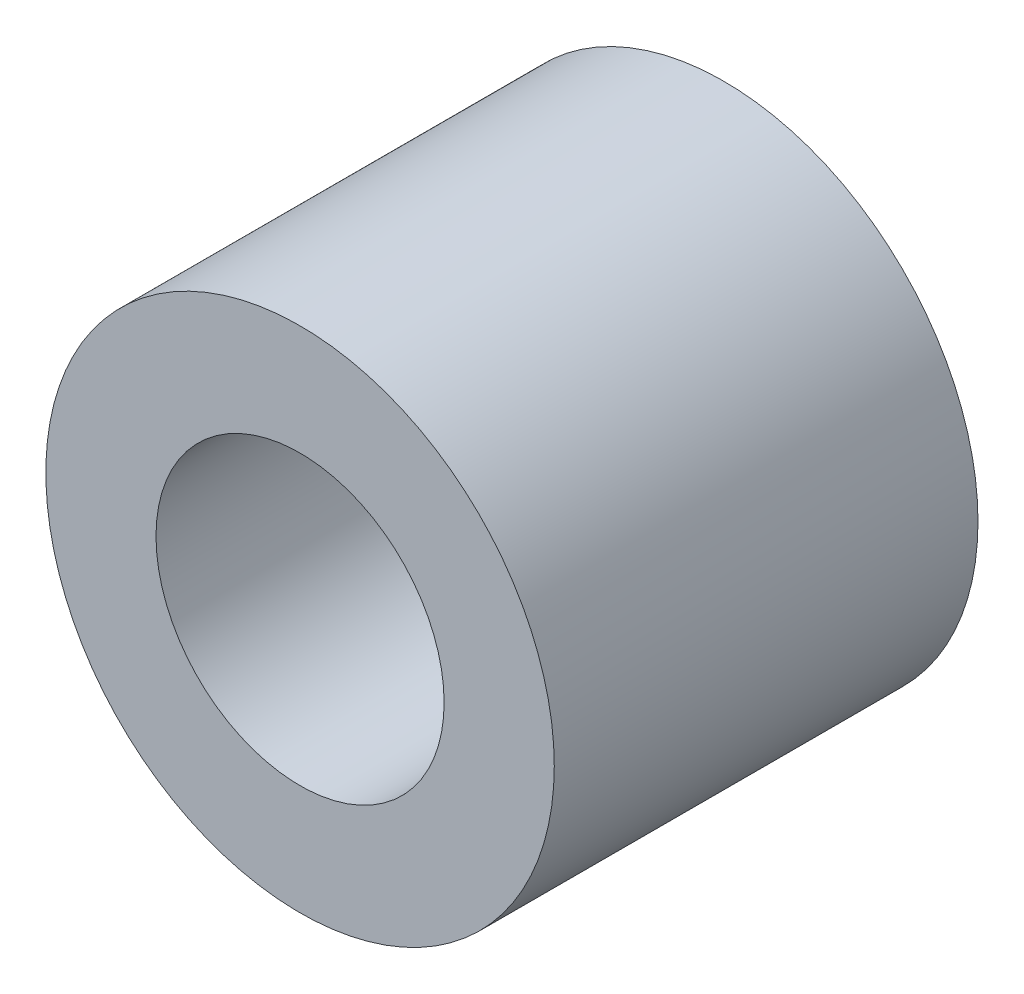
from build123d import *

# Parameters (mm, degrees)
SKETCH2_R           = 3
BOSS_EXTRUDE1_DEPTH = 5
SKETCH3_R           = 1.7
CUT_EXTRUDE1_DEPTH  = 7.557438524


with BuildPart() as part:
    # Sketch2 → Boss-Extrude1 (new body)
    with BuildSketch(Plane(origin=(0, 0, 0), x_dir=(0, 1, 0), z_dir=(0, 0, 1))):
        with Locations(Location((0, 0, 0), (0, 0, 270))):
            Circle(SKETCH2_R)
    extrude(amount=BOSS_EXTRUDE1_DEPTH)

    # Sketch3 → Cut-Extrude1 (cut, through all)
    with BuildSketch(Plane.XY.offset(5)):
        Circle(SKETCH3_R)
    extrude(amount=-CUT_EXTRUDE1_DEPTH, mode=Mode.SUBTRACT)


solid = part.part
